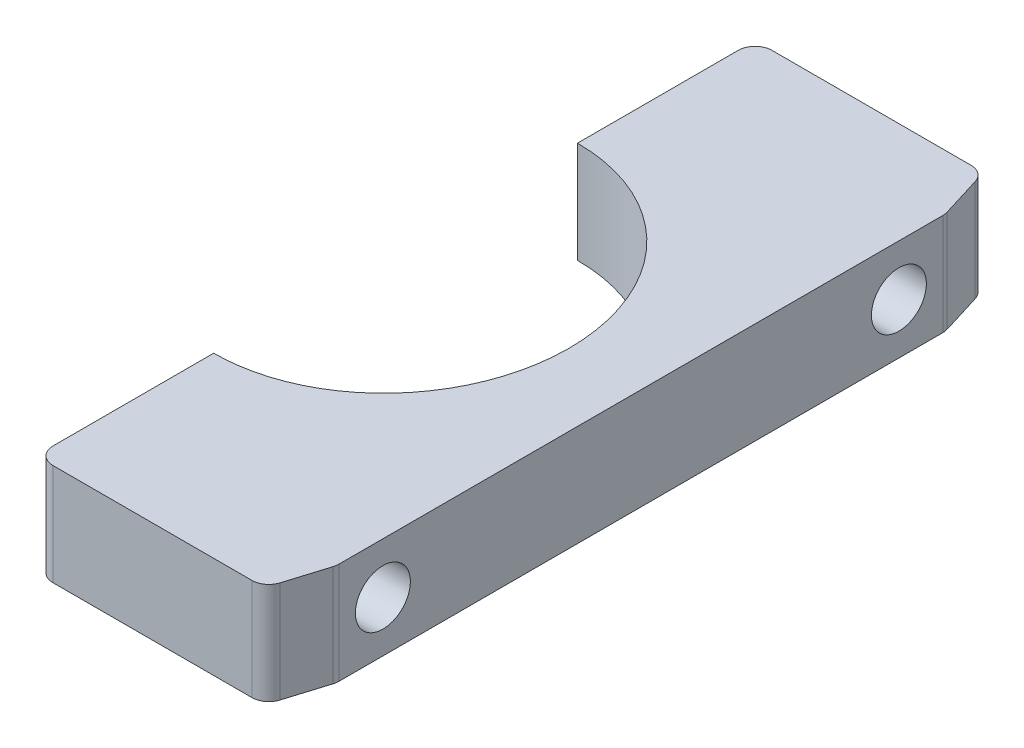
from build123d import *

# Parameters (mm, degrees)
EXTRUDE_1_DEPTH     = 12
FILLET_1_R          = 2
FILLET_2_R          = 2
SKETCH_2_R          = 3.25
CUT_EXTRUDE_1_DEPTH = 53.832281956


with BuildPart() as part:
    # 草圖1 → 填料-伸長1 (new body)
    with BuildSketch(Plane(origin=(0, 0, 0), x_dir=(1, 0, 0), z_dir=(0, 1, 0))):
        with BuildLine():
            Line((0, 21.5), (0, 42.5))
            Line((0, 42.5), (27, 42.5))
            Line((27, 42.5), (29, 36))
            Line((29, 36), (29, -36))
            Line((29, -36), (27, -42.5))
            Line((27, -42.5), (0, -42.5))
            Line((0, -42.5), (0, -21.5))
            add(Edge.make_bspline(
                [(0, -21.5), (20.5, -21.5), (20.5, 0), (20.5, 21.5), (0, 21.5)],
                knots=[3.141592654, 3.141592654, 3.141592654, 4.71238898, 4.71238898, 6.283185307, 6.283185307, 6.283185307], degree=2, weights=[1, 0.707106781, 1, 0.707106781, 1]))
        make_face()
    extrude(amount=EXTRUDE_1_DEPTH)

    # 圓角1
    fillet_1_edges = [part.edges().sort_by_distance(p)[0] for p in [
        (29, 6, 36),
        (27, 6, 42.5),
    ]]
    fillet(fillet_1_edges, radius=FILLET_1_R)

    # 圓角2
    fillet_2_edges = [part.edges().sort_by_distance(p)[0] for p in [
        (0, 6, -42.5),
        (27, 6, -42.5),
        (29, 6, -36),
        (0, 6, 42.5),
    ]]
    fillet(fillet_2_edges, radius=FILLET_2_R)

    # 草圖2 → 除料-伸長1 (cut, through all)
    with BuildSketch(Plane(origin=(29, 0, 0), x_dir=(0, 0, -1), z_dir=(1, 0, 0))):
        with Locations((30.5, 6)):
            Circle(SKETCH_2_R)
        with Locations(Location((-30.5, 6, 0), (0, 0, 180))):
            Circle(SKETCH_2_R)
    extrude(amount=-CUT_EXTRUDE_1_DEPTH, mode=Mode.SUBTRACT)


solid = part.part
